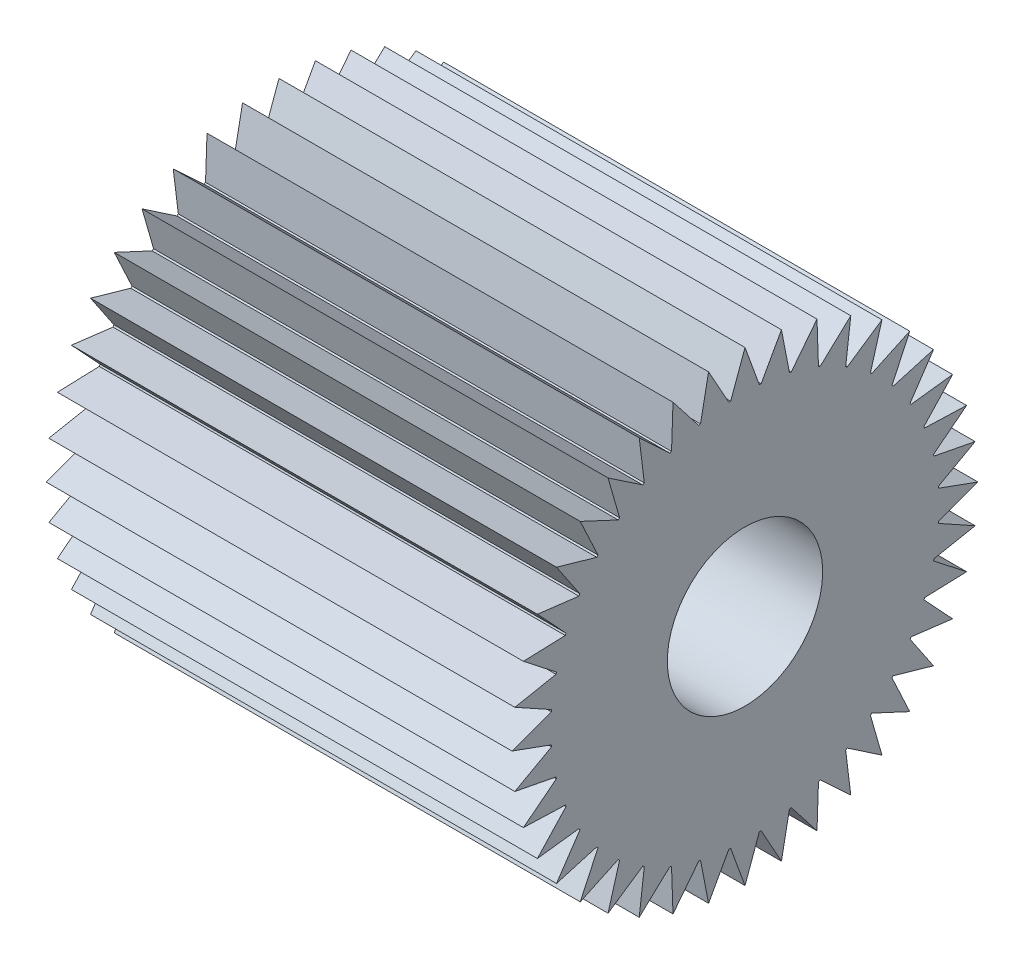
from build123d import *

# Parameters (mm, degrees)
BOSS_EXTRUDE1_DEPTH = 15
SKETCH2_R           = 5
CUT_EXTRUDE2_DEPTH  = 30


with BuildPart() as part:
    # Sketch1 → Boss-Extrude1 (new, symmetric)
    with BuildSketch(Plane(origin=(0, 0, 0), x_dir=(0, 0, -1), z_dir=(1, 0, 0))):
        with BuildLine():
            Line((2.346516976, 14.815325109), (2.861072583, 12.168165995))
            ThreePointArc((2.861072583, 12.168165995), (2.918067048, 12.154624005), (2.974997424, 12.14081506))
            Line((2.974997424, 12.14081506), (4.635254916, 14.265847744))
            Line((4.635254916, 14.265847744), (4.729368569, 11.570785321))
            ThreePointArc((4.729368569, 11.570785321), (4.783542905, 11.548494156), (4.837612178, 11.52594935))
            Line((4.837612178, 11.52594935), (6.809857496, 13.365097863))
            Line((6.809857496, 13.365097863), (6.481211806, 10.688493511))
            ThreePointArc((6.481211806, 10.688493511), (6.531232059, 10.658002054), (6.581108865, 10.627276514))
            Line((6.581108865, 10.627276514), (8.816778784, 12.135254916))
            Line((8.816778784, 12.135254916), (8.073466098, 9.543015517))
            ThreePointArc((8.073466098, 9.543015517), (8.118100604, 9.50507457), (8.16255681, 9.466924861))
            Line((8.16255681, 9.466924861), (10.606601718, 10.606601718))
            Line((10.606601718, 10.606601718), (9.466924861, 8.16255681))
            ThreePointArc((9.466924861, 8.16255681), (9.50507457, 8.118100604), (9.543015517, 8.073466098))
            Line((9.543015517, 8.073466098), (12.135254916, 8.816778784))
            Line((12.135254916, 8.816778784), (10.627276514, 6.581108865))
            ThreePointArc((10.627276514, 6.581108865), (10.658002054, 6.531232059), (10.688493511, 6.481211806))
            Line((10.688493511, 6.481211806), (13.365097863, 6.809857496))
            Line((13.365097863, 6.809857496), (11.52594935, 4.837612178))
            ThreePointArc((11.52594935, 4.837612178), (11.548494156, 4.783542905), (11.570785321, 4.729368569))
            Line((11.570785321, 4.729368569), (14.265847744, 4.635254916))
            Line((14.265847744, 4.635254916), (12.14081506, 2.974997424))
            ThreePointArc((12.14081506, 2.974997424), (12.154624005, 2.918067048), (12.168165995, 2.861072583))
            Line((12.168165995, 2.861072583), (14.815325109, 2.346516976))
            Line((14.815325109, 2.346516976), (12.456733611, 1.03912836))
            ThreePointArc((12.456733611, 1.03912836), (12.461466672, 0.980738697), (12.465926038, 0.922327493))
            Line((12.465926038, 0.922327493), (15, 0))
            Line((15, 0), (12.465926038, -0.922327493))
            ThreePointArc((12.465926038, -0.922327493), (12.461466672, -0.980738697), (12.456733611, -1.03912836))
            Line((12.456733611, -1.03912836), (14.815325109, -2.346516976))
            Line((14.815325109, -2.346516976), (12.168165995, -2.861072583))
            ThreePointArc((12.168165995, -2.861072583), (12.154624005, -2.918067048), (12.14081506, -2.974997424))
            Line((12.14081506, -2.974997424), (14.265847744, -4.635254916))
            Line((14.265847744, -4.635254916), (11.570785321, -4.729368569))
            ThreePointArc((11.570785321, -4.729368569), (11.548494156, -4.783542905), (11.52594935, -4.837612178))
            Line((11.52594935, -4.837612178), (13.365097863, -6.809857496))
            Line((13.365097863, -6.809857496), (10.688493511, -6.481211806))
            ThreePointArc((10.688493511, -6.481211806), (10.658002054, -6.531232059), (10.627276514, -6.581108865))
            Line((10.627276514, -6.581108865), (12.135254916, -8.816778784))
            Line((12.135254916, -8.816778784), (9.543015517, -8.073466098))
            ThreePointArc((9.543015517, -8.073466098), (9.50507457, -8.118100604), (9.466924861, -8.16255681))
            Line((9.466924861, -8.16255681), (10.606601718, -10.606601718))
            Line((10.606601718, -10.606601718), (8.16255681, -9.466924861))
            ThreePointArc((8.16255681, -9.466924861), (8.118100604, -9.50507457), (8.073466098, -9.543015517))
            Line((8.073466098, -9.543015517), (8.816778784, -12.135254916))
            Line((8.816778784, -12.135254916), (6.581108865, -10.627276514))
            ThreePointArc((6.581108865, -10.627276514), (6.531232059, -10.658002054), (6.481211806, -10.688493511))
            Line((6.481211806, -10.688493511), (6.809857496, -13.365097863))
            Line((6.809857496, -13.365097863), (4.837612178, -11.52594935))
            ThreePointArc((4.837612178, -11.52594935), (4.783542905, -11.548494156), (4.729368569, -11.570785321))
            Line((4.729368569, -11.570785321), (4.635254916, -14.265847744))
            Line((4.635254916, -14.265847744), (2.974997424, -12.14081506))
            ThreePointArc((2.974997424, -12.14081506), (2.918067048, -12.154624005), (2.861072583, -12.168165995))
            Line((2.861072583, -12.168165995), (2.346516976, -14.815325109))
            Line((2.346516976, -14.815325109), (1.03912836, -12.456733611))
            ThreePointArc((1.03912836, -12.456733611), (0.980738697, -12.461466672), (0.922327493, -12.465926038))
            Line((0.922327493, -12.465926038), (0, -15))
            Line((0, -15), (-0.922327493, -12.465926038))
            ThreePointArc((-0.922327493, -12.465926038), (-0.980738697, -12.461466672), (-1.03912836, -12.456733611))
            Line((-1.03912836, -12.456733611), (-2.346516976, -14.815325109))
            Line((-2.346516976, -14.815325109), (-2.861072583, -12.168165995))
            ThreePointArc((-2.861072583, -12.168165995), (-2.918067048, -12.154624005), (-2.974997424, -12.14081506))
            Line((-2.974997424, -12.14081506), (-4.635254916, -14.265847744))
            Line((-4.635254916, -14.265847744), (-4.729368569, -11.570785321))
            ThreePointArc((-4.729368569, -11.570785321), (-4.783542905, -11.548494156), (-4.837612178, -11.52594935))
            Line((-4.837612178, -11.52594935), (-6.809857496, -13.365097863))
            Line((-6.809857496, -13.365097863), (-6.481211806, -10.688493511))
            ThreePointArc((-6.481211806, -10.688493511), (-6.531232059, -10.658002054), (-6.581108865, -10.627276514))
            Line((-6.581108865, -10.627276514), (-8.816778784, -12.135254916))
            Line((-8.816778784, -12.135254916), (-8.073466098, -9.543015517))
            ThreePointArc((-8.073466098, -9.543015517), (-8.118100604, -9.50507457), (-8.16255681, -9.466924861))
            Line((-8.16255681, -9.466924861), (-10.606601718, -10.606601718))
            Line((-10.606601718, -10.606601718), (-9.466924861, -8.16255681))
            ThreePointArc((-9.466924861, -8.16255681), (-9.50507457, -8.118100604), (-9.543015517, -8.073466098))
            Line((-9.543015517, -8.073466098), (-12.135254916, -8.816778784))
            Line((-12.135254916, -8.816778784), (-10.627276514, -6.581108865))
            ThreePointArc((-10.627276514, -6.581108865), (-10.658002054, -6.531232059), (-10.688493511, -6.481211806))
            Line((-10.688493511, -6.481211806), (-13.365097863, -6.809857496))
            Line((-13.365097863, -6.809857496), (-11.52594935, -4.837612178))
            ThreePointArc((-11.52594935, -4.837612178), (-11.548494156, -4.783542905), (-11.570785321, -4.729368569))
            Line((-11.570785321, -4.729368569), (-14.265847744, -4.635254916))
            Line((-14.265847744, -4.635254916), (-12.14081506, -2.974997424))
            ThreePointArc((-12.14081506, -2.974997424), (-12.154624005, -2.918067048), (-12.168165995, -2.861072583))
            Line((-12.168165995, -2.861072583), (-14.815325109, -2.346516976))
            Line((-14.815325109, -2.346516976), (-12.456733611, -1.03912836))
            ThreePointArc((-12.456733611, -1.03912836), (-12.461466672, -0.980738697), (-12.465926038, -0.922327493))
            Line((-12.465926038, -0.922327493), (-15, 0))
            Line((-15, 0), (-12.465926038, 0.922327493))
            ThreePointArc((-12.465926038, 0.922327493), (-12.461466672, 0.980738697), (-12.456733611, 1.03912836))
            Line((-12.456733611, 1.03912836), (-14.815325109, 2.346516976))
            Line((-14.815325109, 2.346516976), (-12.168165995, 2.861072583))
            ThreePointArc((-12.168165995, 2.861072583), (-12.154624005, 2.918067048), (-12.14081506, 2.974997424))
            Line((-12.14081506, 2.974997424), (-14.265847744, 4.635254916))
            Line((-14.265847744, 4.635254916), (-11.570785321, 4.729368569))
            ThreePointArc((-11.570785321, 4.729368569), (-11.548494156, 4.783542905), (-11.52594935, 4.837612178))
            Line((-11.52594935, 4.837612178), (-13.365097863, 6.809857496))
            Line((-13.365097863, 6.809857496), (-10.688493511, 6.481211806))
            ThreePointArc((-10.688493511, 6.481211806), (-10.658002054, 6.531232059), (-10.627276514, 6.581108865))
            Line((-10.627276514, 6.581108865), (-12.135254916, 8.816778784))
            Line((-12.135254916, 8.816778784), (-9.543015517, 8.073466098))
            ThreePointArc((-9.543015517, 8.073466098), (-9.50507457, 8.118100604), (-9.466924861, 8.16255681))
            Line((-9.466924861, 8.16255681), (-10.606601718, 10.606601718))
            Line((-10.606601718, 10.606601718), (-8.16255681, 9.466924861))
            ThreePointArc((-8.16255681, 9.466924861), (-8.118100604, 9.50507457), (-8.073466098, 9.543015517))
            Line((-8.073466098, 9.543015517), (-8.816778784, 12.135254916))
            Line((-8.816778784, 12.135254916), (-6.581108865, 10.627276514))
            ThreePointArc((-6.581108865, 10.627276514), (-6.531232059, 10.658002054), (-6.481211806, 10.688493511))
            Line((-6.481211806, 10.688493511), (-6.809857496, 13.365097863))
            Line((-6.809857496, 13.365097863), (-4.837612178, 11.52594935))
            ThreePointArc((-4.837612178, 11.52594935), (-4.783542905, 11.548494156), (-4.729368569, 11.570785321))
            Line((-4.729368569, 11.570785321), (-4.635254916, 14.265847744))
            Line((-4.635254916, 14.265847744), (-2.974997424, 12.14081506))
            ThreePointArc((-2.974997424, 12.14081506), (-2.918067048, 12.154624005), (-2.861072583, 12.168165995))
            Line((-2.861072583, 12.168165995), (-2.346516976, 14.815325109))
            Line((-2.346516976, 14.815325109), (-1.03912836, 12.456733611))
            ThreePointArc((-1.03912836, 12.456733611), (-0.980738697, 12.461466672), (-0.922327493, 12.465926038))
            Line((-0.922327493, 12.465926038), (0, 15))
            Line((0, 15), (0.922327493, 12.465926038))
            ThreePointArc((0.922327493, 12.465926038), (0.980738697, 12.461466672), (1.03912836, 12.456733611))
            Line((1.03912836, 12.456733611), (2.346516976, 14.815325109))
        make_face()
    extrude(amount=BOSS_EXTRUDE1_DEPTH, both=True)

    # Sketch2 → Cut-Extrude2 (cut)
    with BuildSketch(Plane(origin=(15, 0, 0), x_dir=(0, 0, -1), z_dir=(1, 0, 0))):
        Circle(SKETCH2_R)
    extrude(amount=-CUT_EXTRUDE2_DEPTH, mode=Mode.SUBTRACT)


solid = part.part
